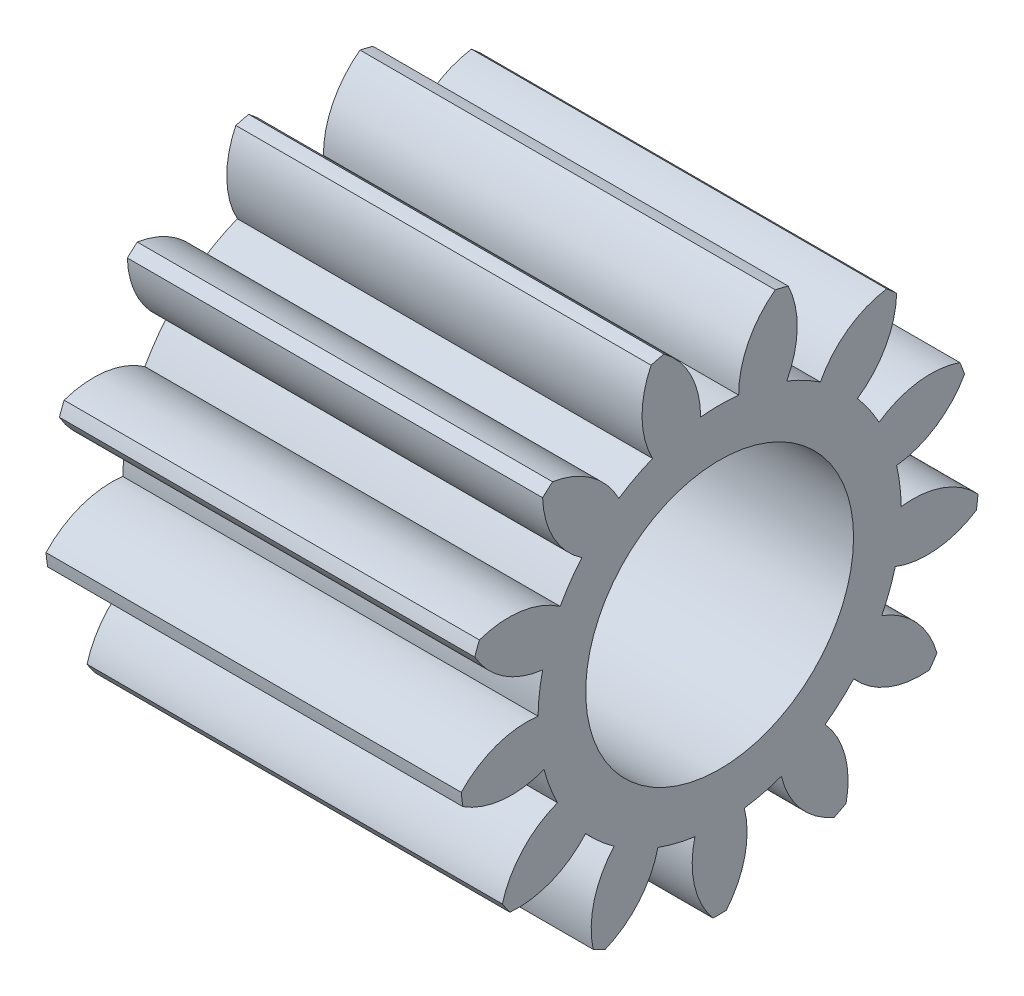
from build123d import *

# Parameters (mm, degrees)
BASPROSKE_W        = 6
BASPROSKE_H        = 3.75
TOOTHCUT_DEPTH     = 9.007808689
TEETHCUTS_COUNT    = 13
TEETHCUTS_ANGLE    = 332.307692308
BORSKE_R           = 0.4
BORE_DEPTH         = 50.0000508
SKETCH6_R          = 1.935
CUT_EXTRUDE1_DEPTH = 5


with BuildPart() as part:
    # BasProSke → Base-Revolve (revolve)
    with BuildSketch(Plane(origin=(0, 0, 0), x_dir=(1, 0, 0), z_dir=(0, 1, 0)), mode=Mode.PRIVATE) as base_revolve_sk:
        with Locations((3, 1.875)):
            Rectangle(BASPROSKE_W, BASPROSKE_H)
    revolve(base_revolve_sk.sketch.rotate(Axis((-10, 0, 0), (1, 0, 0)), 180), axis=Axis((-10, 0, 0), (1, 0, 0)))

    # TooCutSke → ToothCut (cut, through all)
    with BuildSketch(Plane(origin=(0, 0, 0), x_dir=(0, 0, -1), z_dir=(1, 0, 0))):
        with BuildLine():
            ThreePointArc((0.275247387, 2.609523879), (0, 2.624), (-0.275247387, 2.609523879))
            ThreePointArc((-0.275247387, 2.609523879), (-0.421084752, 3.214694797), (-0.831556081, 3.682683756))
            ThreePointArc((-0.831556081, 3.682683756), (0, 3.7754), (0.831556081, 3.682683756))
            ThreePointArc((0.831556081, 3.682683756), (0.421084752, 3.214694797), (0.275247387, 2.609523879))
        make_face()
    toothcut = extrude(amount=TOOTHCUT_DEPTH, mode=Mode.SUBTRACT)

    # TeethCuts: ToothCut ×13 about axis
    teethcuts_axis = Axis((-10, 0, 0), (1, 0, 0))
    for i in range(1, TEETHCUTS_COUNT):
        add(toothcut.rotate(teethcuts_axis, i * TEETHCUTS_ANGLE / (TEETHCUTS_COUNT - 1)), mode=Mode.SUBTRACT)

    # BorSke → Bore (cut, symmetric)
    with BuildSketch(Plane(origin=(0, 0, 0), x_dir=(0, 0, -1), z_dir=(1, 0, 0))):
        with Locations(Location((0, 0, 0), (0, 0, 180))):
            Circle(BORSKE_R)
    extrude(amount=BORE_DEPTH, both=True, mode=Mode.SUBTRACT)

    # Sketch6 → Cut-Extrude1 (cut)
    with BuildSketch(Plane(origin=(6, 0, 0), x_dir=(0, 0, -1), z_dir=(1, 0, 0))):
        Circle(SKETCH6_R)
    extrude(amount=-CUT_EXTRUDE1_DEPTH, mode=Mode.SUBTRACT)


solid = part.part
